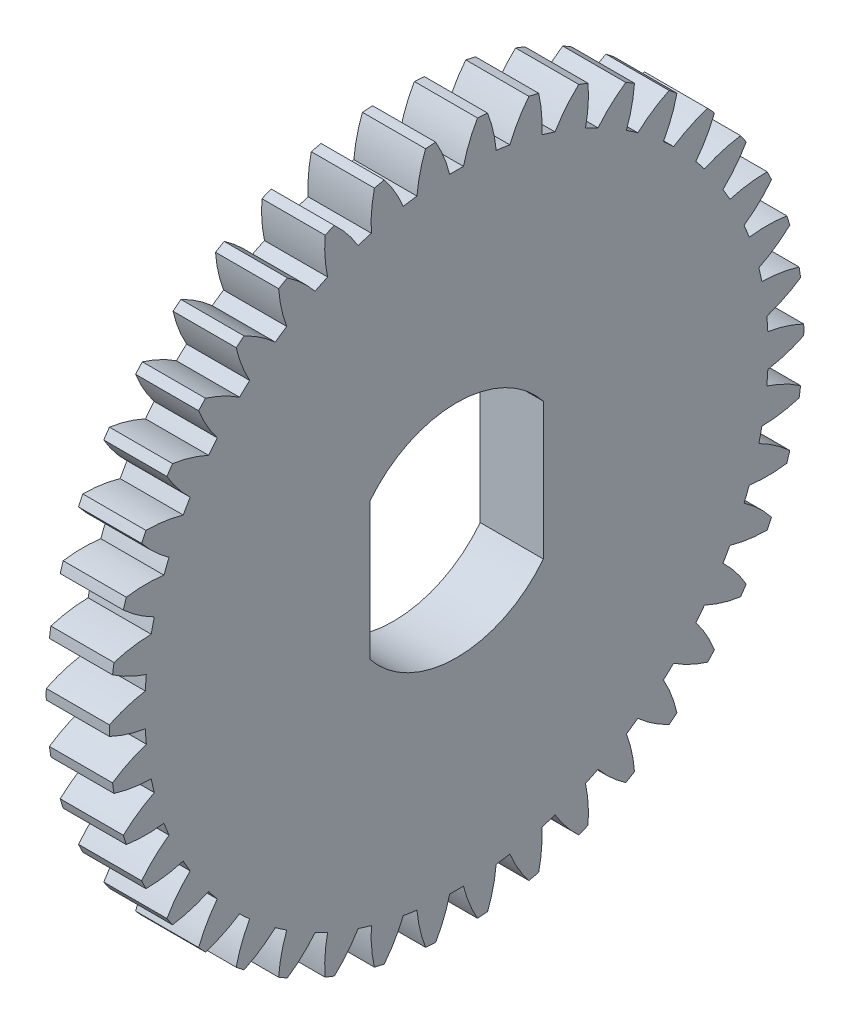
from build123d import *

# Parameters (mm, degrees)
BASPROSKE_W        = 8
BASPROSKE_H        = 44
TOOTHCUT_DEPTH     = 63.737548565
TEETHCUTS_COUNT    = 42
TEETHCUTS_ANGLE    = 351.428571429
BORSKE_R           = 7
BORE_DEPTH         = 50.0000508
CUT_EXTRUDE2_DEPTH = 10


with BuildPart() as part:
    # BasProSke → Base-Revolve (revolve)
    with BuildSketch(Plane(origin=(0, 0, 0), x_dir=(1, 0, 0), z_dir=(0, 1, 0)), mode=Mode.PRIVATE) as base_revolve_sk:
        with Locations((4, 22)):
            Rectangle(BASPROSKE_W, BASPROSKE_H)
    revolve(base_revolve_sk.sketch.rotate(Axis((-10, 0, 0), (1, 0, 0)), 180), axis=Axis((-10, 0, 0), (1, 0, 0)))

    # TooCutSke → ToothCut (cut, through all)
    with BuildSketch(Plane(origin=(0, 0, 0), x_dir=(0, 0, -1), z_dir=(1, 0, 0))):
        with BuildLine():
            ThreePointArc((0.877582471, 39.489249803), (0, 39.499), (-0.877582471, 39.489249803))
            ThreePointArc((-0.877582471, 39.489249803), (-1.612128187, 41.781146885), (-2.666625076, 43.944566853))
            ThreePointArc((-2.666625076, 43.944566853), (0, 44.0254), (2.666625076, 43.944566853))
            ThreePointArc((2.666625076, 43.944566853), (1.612128187, 41.781146885), (0.877582471, 39.489249803))
        make_face()
    toothcut = extrude(amount=TOOTHCUT_DEPTH, mode=Mode.SUBTRACT)

    # TeethCuts: ToothCut ×42 about axis
    teethcuts_axis = Axis((-10, 0, 0), (1, 0, 0))
    for i in range(1, TEETHCUTS_COUNT):
        add(toothcut.rotate(teethcuts_axis, i * TEETHCUTS_ANGLE / (TEETHCUTS_COUNT - 1)), mode=Mode.SUBTRACT)

    # BorSke → Bore (cut, symmetric)
    with BuildSketch(Plane(origin=(0, 0, 0), x_dir=(0, 0, -1), z_dir=(1, 0, 0))):
        with Locations(Location((0, 0, 0), (0, 0, 180))):
            Circle(BORSKE_R)
    extrude(amount=BORE_DEPTH, both=True, mode=Mode.SUBTRACT)

    # Sketch1 → Cut-Extrude2 (cut)
    with BuildSketch(Plane.ZY):
        with BuildLine():
            Line((-11, 8.660254038), (-11, -8.660254038))
            ThreePointArc((-11, -8.660254038), (0, -14), (11, -8.660254038))
            Line((11, -8.660254038), (11, 8.660254038))
            ThreePointArc((11, 8.660254038), (0, 14), (-11, 8.660254038))
        make_face()
    extrude(amount=-CUT_EXTRUDE2_DEPTH, mode=Mode.SUBTRACT)


solid = part.part
